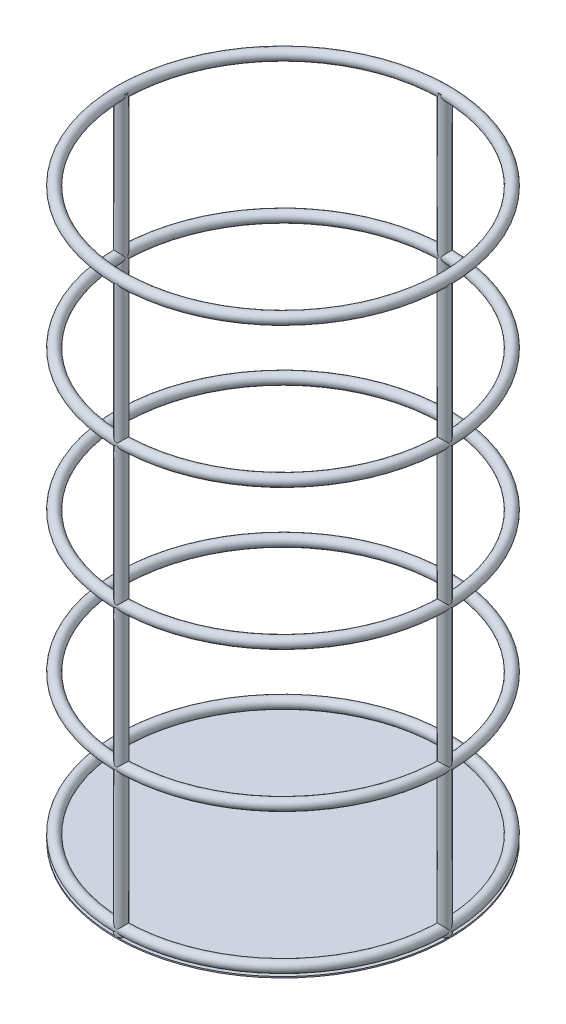
from build123d import *
from build123d.topology import SkipClean

# Parameters (mm, degrees)
SKETCH1_R           = 125
BOSS_EXTRUDE1_DEPTH = 1
SKETCH2_R           = 4
BOSS_EXTRUDE2_DEPTH = 425
CIRPATTERN1_COUNT   = 4
SKETCH3_R           = 4
LPATTERN2_COUNT     = 5
LPATTERN2_PITCH     = 105


with BuildPart() as part:
    # Sketch1 → Boss-Extrude1 (new body)
    with BuildSketch(Plane(origin=(0, 0, 0), x_dir=(1, 0, 0), z_dir=(0, 1, 0))):
        with Locations(Location((0, 0, 0), (0, 0, 270))):
            Circle(SKETCH1_R)
    extrude(amount=BOSS_EXTRUDE1_DEPTH)

    # Sketch2 → Boss-Extrude2 (add)
    with BuildSketch(Plane(origin=(0, 1, 0), x_dir=(1, 0, 0), z_dir=(0, 1, 0))):
        with Locations(Location((0, 121, 0), (0, 0, 89.999587918))):
            Circle(SKETCH2_R)
    boss_extrude2 = extrude(amount=BOSS_EXTRUDE2_DEPTH)

    # CirPattern1: Boss-Extrude2 ×4 about axis
    cirpattern1_axis = Axis((0, 0, 0), (0, 1, 0))
    for i in range(1, CIRPATTERN1_COUNT):
        add(boss_extrude2.rotate(cirpattern1_axis, i * 360 / CIRPATTERN1_COUNT))


with BuildPart() as body_2:
    # Sketch3 → Revolve2 (revolve)
    with BuildSketch(Plane.XY, mode=Mode.PRIVATE) as revolve2_sk:
        with Locations((-121.096298684, 5)):
            Circle(SKETCH3_R)
    revolve2 = revolve(revolve2_sk.sketch.rotate(Axis((0, 13.410088934, 0), (0, -1, 0)), 270), axis=Axis((0, 13.410088934, 0), (0, -1, 0)))


with BuildPart() as part_1:
    with SkipClean():  # the faces are left unmerged after this step: merging them gives an invalid solid
        add(part.part)

        # LPattern2: Revolve2 ×5
        with Locations(*[(0, i * LPATTERN2_PITCH, 0) for i in range(1, LPATTERN2_COUNT)]):
            add(revolve2)


solid = Compound([body_2.part, part_1.part])
